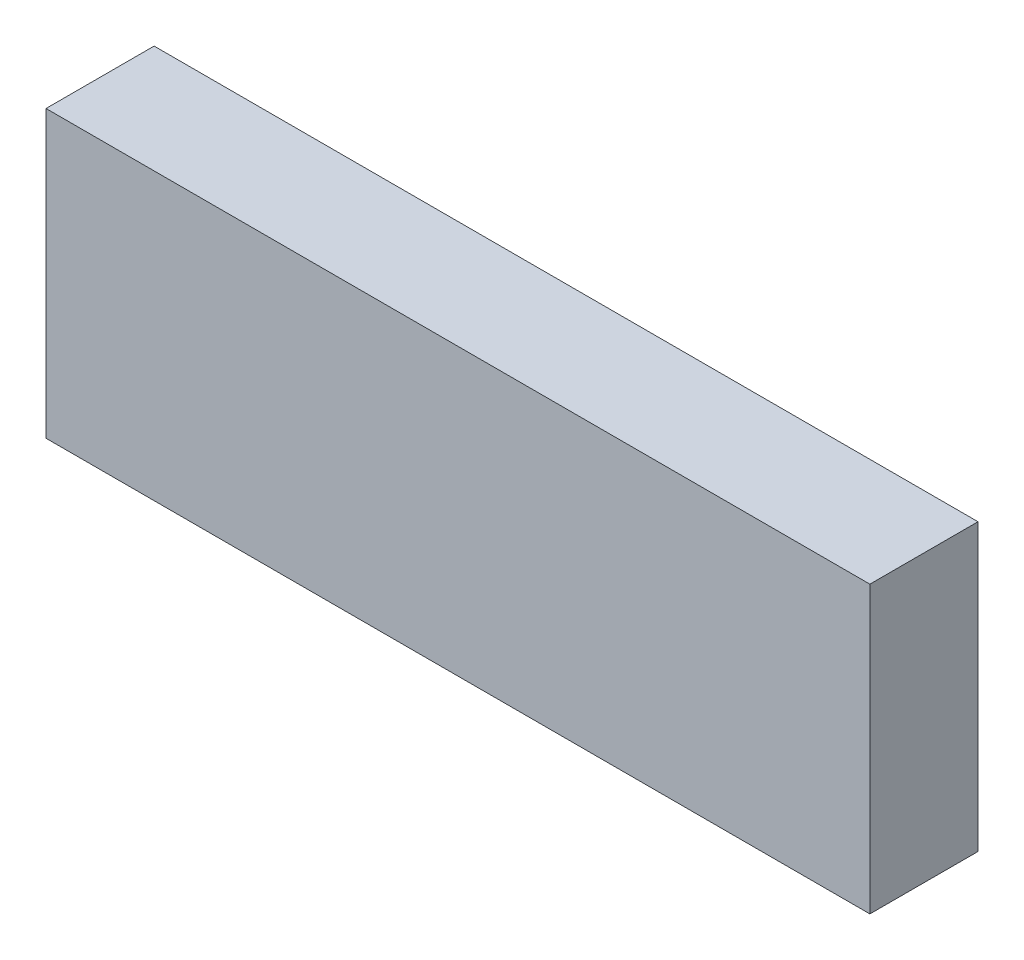
from build123d import *

# Parameters (mm, degrees)
SKETCH1_W               = 7.62
SKETCH1_H               = 2.6416
COMPONENT_OUTLINE_DEPTH = 1


with BuildPart() as part:
    # Sketch1 → Component_Outline (new body)
    with BuildSketch(Plane.XY):
        with Locations((2.54, 0.0508)):
            Rectangle(SKETCH1_W, SKETCH1_H)
    extrude(amount=COMPONENT_OUTLINE_DEPTH)


solid = part.part
